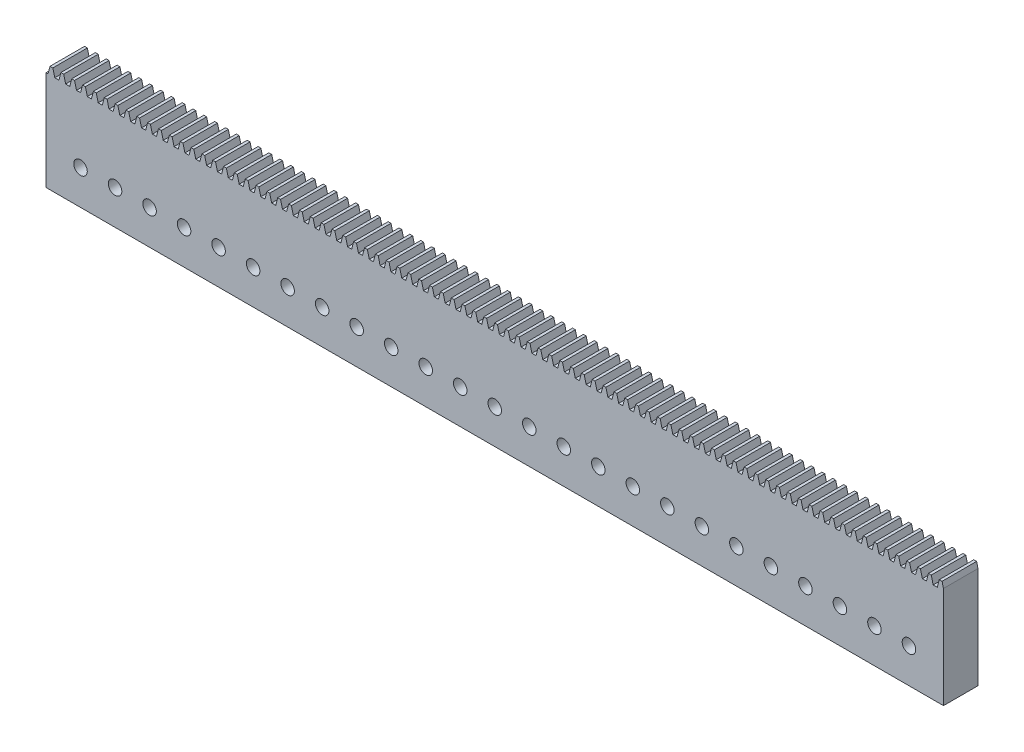
from build123d import *

# Parameters (mm, degrees)
BLANKSKE_W                 = 330.2
BLANKSKE_H                 = 39.37
BLANK_DEPTH                = 12.7
TOOTHCUTSIM_DEPTH          = 333.781199739
TEETHCUTS_COUNT            = 84
TEETHCUTS_PITCH            = 3.989822666
F_9_0_196_DIAMETER_HOLE1_D = 4.9784


with BuildPart() as part:
    # BlankSke → Blank (new body)
    with BuildSketch(Plane.XY):
        with Locations((165.1, 19.685)):
            Rectangle(BLANKSKE_W, BLANKSKE_H)
    extrude(amount=-BLANK_DEPTH)

    # TooCutSkeSim → ToothCutSim (cut, through all)
    with BuildSketch(Plane.XY):
        Polygon((0.755722468, 36.576), (-0.755722468, 36.576), (-1.484868885, 39.3954), (1.484868885, 39.3954), align=None)
    toothcutsim = extrude(amount=-TOOTHCUTSIM_DEPTH, mode=Mode.SUBTRACT)

    # TeethCuts: ToothCutSim ×84
    with Locations(*[(i * TEETHCUTS_PITCH, 0, 0) for i in range(1, TEETHCUTS_COUNT)]):
        add(toothcutsim, mode=Mode.SUBTRACT)

    # #9 (0.196) Diameter Hole1 (through all)
    with Locations(Plane.XY):
        with Locations((12.7, 12.7), (25.4, 12.7), (38.1, 12.7), (50.8, 12.7), (63.5, 12.7), (76.2, 12.7), (88.9, 12.7), (101.6, 12.7), (114.3, 12.7), (127, 12.7), (139.7, 12.7), (152.4, 12.7), (165.1, 12.7), (177.8, 12.7), (190.5, 12.7), (203.2, 12.7), (215.9, 12.7), (228.6, 12.7), (241.3, 12.7), (254, 12.7), (266.7, 12.7), (279.4, 12.7), (292.1, 12.7), (304.8, 12.7), (317.5, 12.7)):
            Hole(F_9_0_196_DIAMETER_HOLE1_D / 2)


solid = part.part
